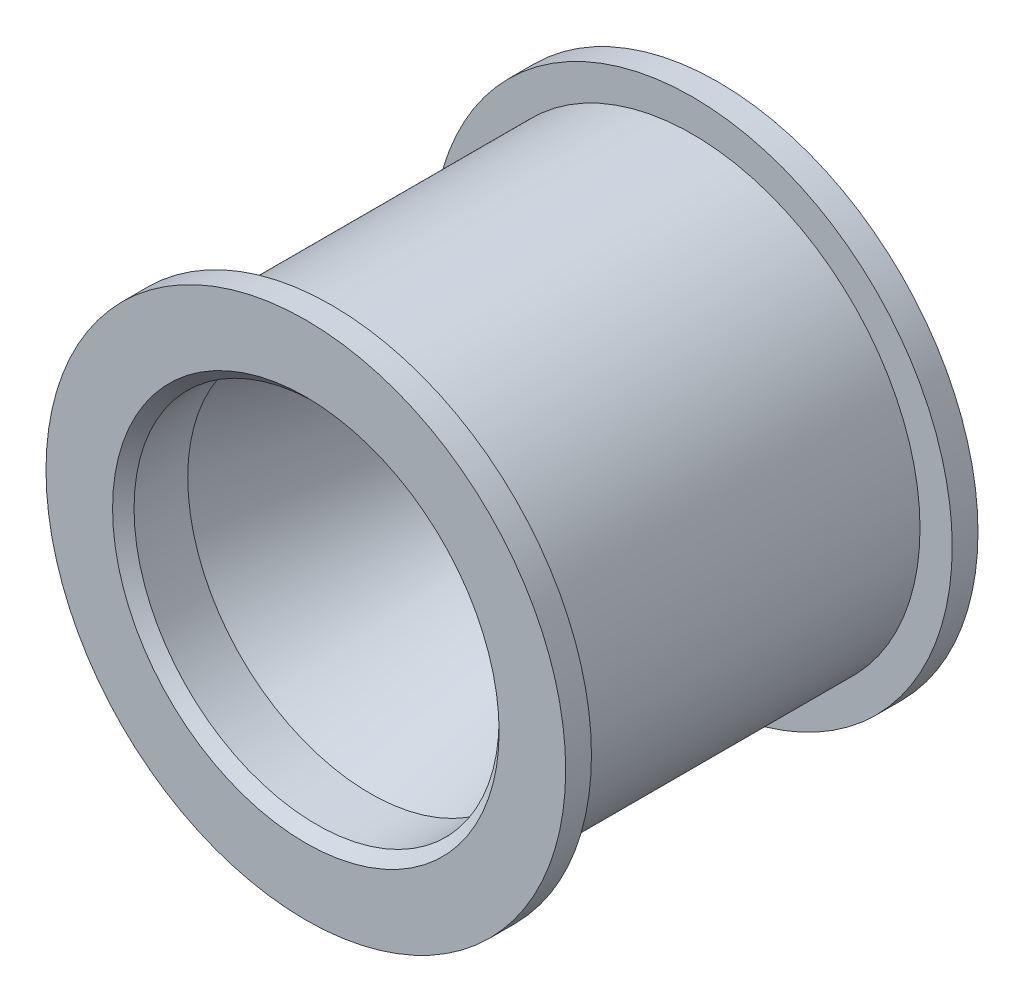
from build123d import *
from OCP.BRepFilletAPI import BRepFilletAPI_MakeChamfer

# Parameters (mm, degrees)
LAUFRAD_DEPTH             = 8.4
LAUFRAD_DEPTH_BACK        = 8.4
SKIZZE1_R                 = 10.6
SKIZZE2_R                 = 12.1
KETTENF_HRUNG_DEPTH       = 1.2
SKIZZE4_R                 = 1.65
SCHRAUBENBOHRUNG_M3_DEPTH = 26.718864672
SKIZZE3_R                 = 4.1
KUGELLAGERSITZ_DEPTH      = 4
FASE1_SIZE                = 0.5
FASE1_SIZE2               = 0.71146453


with BuildPart() as part:
    # Skizze1 → Laufrad (new, two sides: drawn at the far end of the back side and taken through both)
    with BuildSketch(Plane.XY.offset(-LAUFRAD_DEPTH_BACK)):
        Circle(SKIZZE1_R)
    extrude(amount=LAUFRAD_DEPTH + LAUFRAD_DEPTH_BACK)

    # Skizze2 → Kettenführung (add)
    with BuildSketch(Plane.XY.offset(8.4)):
        Circle(SKIZZE2_R)
    kettenf_hrung = extrude(amount=KETTENF_HRUNG_DEPTH)

    # Spiegeln Kettenführung: Kettenführung across plane
    add(kettenf_hrung.mirror(Plane.XY))

    # Skizze4 → SchraubenBohrung M3 (cut, through all)
    with BuildSketch(Plane(origin=(0, 0, -9.6), x_dir=(-1, 0, 0), z_dir=(0, 0, -1))):
        Circle(SKIZZE4_R)
    extrude(amount=-SCHRAUBENBOHRUNG_M3_DEPTH, mode=Mode.SUBTRACT)

    # Skizze3 → Kugellagersitz (cut)
    with BuildSketch(Plane(origin=(0, 0, -9.6), x_dir=(-1, 0, 0), z_dir=(0, 0, -1))):
        Circle(SKIZZE3_R)
    extrude(amount=-KUGELLAGERSITZ_DEPTH, mode=Mode.SUBTRACT)

    # Skizze5 → Schnitt-Rotation3 (revolve, cut)
    with BuildSketch(Plane(origin=(0, 0, 0), x_dir=(0, 0, -1), z_dir=(1, 0, 0))):
        Polygon((-9.6, 0), (-9.6, 8.5), (-6.6, 8.5), (2.6, 6), (2.6, 0), align=None)
    revolve(axis=Axis((0, 0, -8.4), (0, 0, 1)), mode=Mode.SUBTRACT)

    # Fase1: one chamfer whose edges measure the first distance from different faces: ONE call of the kernel's chamfer builder (chamfer() names one face for all edges)
    fase1_edges_1 = [part.edges().sort_by_distance(p)[0] for p in [
        (1.65, 0, -2.6),
        (1.65, 0, -5.6),
        (4.1, 0, -9.6),
        (0, -8.5, 9.6),
    ]]
    fase1_edges_2 = [part.edges().sort_by_distance(p)[0] for p in [
        (0, -6, -2.6),
    ]]
    fase1_side_2 = [part.faces().sort_by_distance(p)[0] for p in [
        (0, -5.830294373, -2.6),
    ]]
    fase1 = BRepFilletAPI_MakeChamfer(part.part.solid().wrapped)
    for e in fase1_edges_1:
        fase1.Add(FASE1_SIZE, e.wrapped)
    for e in fase1_edges_2:
        fase1.Add(FASE1_SIZE, FASE1_SIZE2, e.wrapped, fase1_side_2[0].wrapped)  # the first distance lies on this face
    add(Compound.cast(fase1.Shape()), mode=Mode.REPLACE)


solid = part.part
